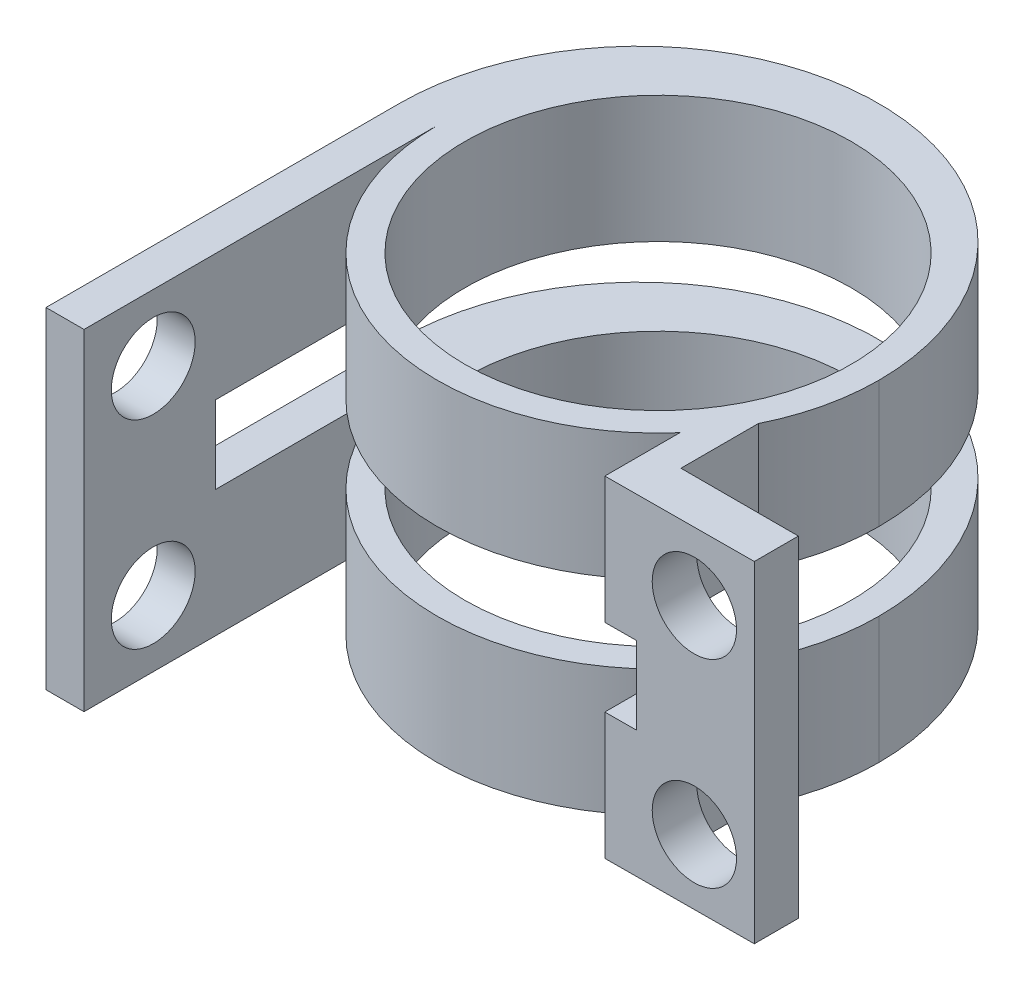
from build123d import *

# Parameters (mm, degrees)
SKETCH1_R           = 8.75
BOSS_EXTRUDE1_DEPTH = 15
SKETCH2_R           = 1.9
CUT_EXTRUDE1_DEPTH  = 20
SKETCH3_R           = 1.9
CUT_EXTRUDE2_DEPTH  = 10
SKETCH4_W           = 24.600517232
SKETCH4_H           = 3.517349106
SKETCH4_W_2         = 3.50600932
SKETCH4_W_3         = 2.117023419
CUT_EXTRUDE3_DEPTH  = 129
SKETCH5_W           = 14.928012143
SKETCH5_H           = 3.517349106
CUT_EXTRUDE4_DEPTH  = 39.5


with BuildPart() as part:
    # Sketch1 → Boss-Extrude1 (new body)
    with BuildSketch(Plane(origin=(0, 0, 0), x_dir=(1, 0, 0), z_dir=(0, 1, 0))):
        with BuildLine():
            Line((7.55, -6.557247898), (7.55, -9.961620247))
            Line((7.55, -9.961620247), (14.289149279, -9.92724627))
            Line((14.289149279, -9.92724627), (14.289149279, -7.931016803))
            Line((14.289149279, -7.931016803), (8.967681349, -7.931016803))
            Line((8.967681349, -7.931016803), (8.967681349, -4.425007483))
            ThreePointArc((8.967681349, -4.425007483), (9.738501258, -2.271914007), (10, 0))
            ThreePointArc((10, 0), (-0.861319558, 10.861319558), (-11.722639117, 0))
            Line((-11.722639117, 0), (-11.722639117, -16.005864092))
            Line((-11.722639117, -16.005864092), (-10, -16.005864092))
            Line((-10, -16.005864092), (-10, 0))
            ThreePointArc((-10, 0), (-3.5, -9.367496998), (7.55, -6.557247898))
        make_face()
        with Locations(Location((0, 0, 0), (0, 0, 270))):
            Circle(SKETCH1_R, mode=Mode.SUBTRACT)
    extrude(amount=-BOSS_EXTRUDE1_DEPTH)

    # Sketch2 → Cut-Extrude1 (cut, symmetric)
    with BuildSketch(Plane.ZY.offset(10.823854245)):
        with Locations(Location((12.870484291, -12, 0), (0, 0, 180))):
            Circle(SKETCH2_R)
        with Locations(Location((12.870484291, -3, 0), (0, 0, 180))):
            Circle(SKETCH2_R)
    extrude(amount=CUT_EXTRUDE1_DEPTH, both=True, mode=Mode.SUBTRACT)

    # Sketch3 → Cut-Extrude2 (cut)
    with BuildSketch(Plane(origin=(0, 0, 7.931016803), x_dir=(-1, 0, 0), z_dir=(0, 0, -1))):
        with Locations((-11.586638558, -12.051447382)):
            Circle(SKETCH3_R)
        with Locations((-11.586638558, -3.07185738)):
            Circle(SKETCH3_R)
    extrude(amount=-CUT_EXTRUDE2_DEPTH, mode=Mode.SUBTRACT)

    # Sketch4 → Cut-Extrude3 (cut)
    with BuildSketch(Plane(origin=(8.967681349, 0, 0), x_dir=(0, 0, -1), z_dir=(1, 0, 0))):
        with Locations((7.875251133, -7.5)):
            Rectangle(SKETCH4_W, SKETCH4_H)
        with Locations((-6.178012143, -7.5)):
            Rectangle(SKETCH4_W_2, SKETCH4_H)
        with Locations((-8.989528513, -7.5)):
            Rectangle(SKETCH4_W_3, SKETCH4_H)
    extrude(amount=-CUT_EXTRUDE3_DEPTH, mode=Mode.SUBTRACT)

    # Sketch5 → Cut-Extrude4 (cut, symmetric)
    with BuildSketch(Plane(origin=(-10, 0, 0), x_dir=(0, 0, -1), z_dir=(1, 0, 0))):
        with Locations((1.285993928, -7.5)):
            Rectangle(SKETCH5_W, SKETCH5_H)
    extrude(amount=CUT_EXTRUDE4_DEPTH, both=True, mode=Mode.SUBTRACT)


solid = part.part
